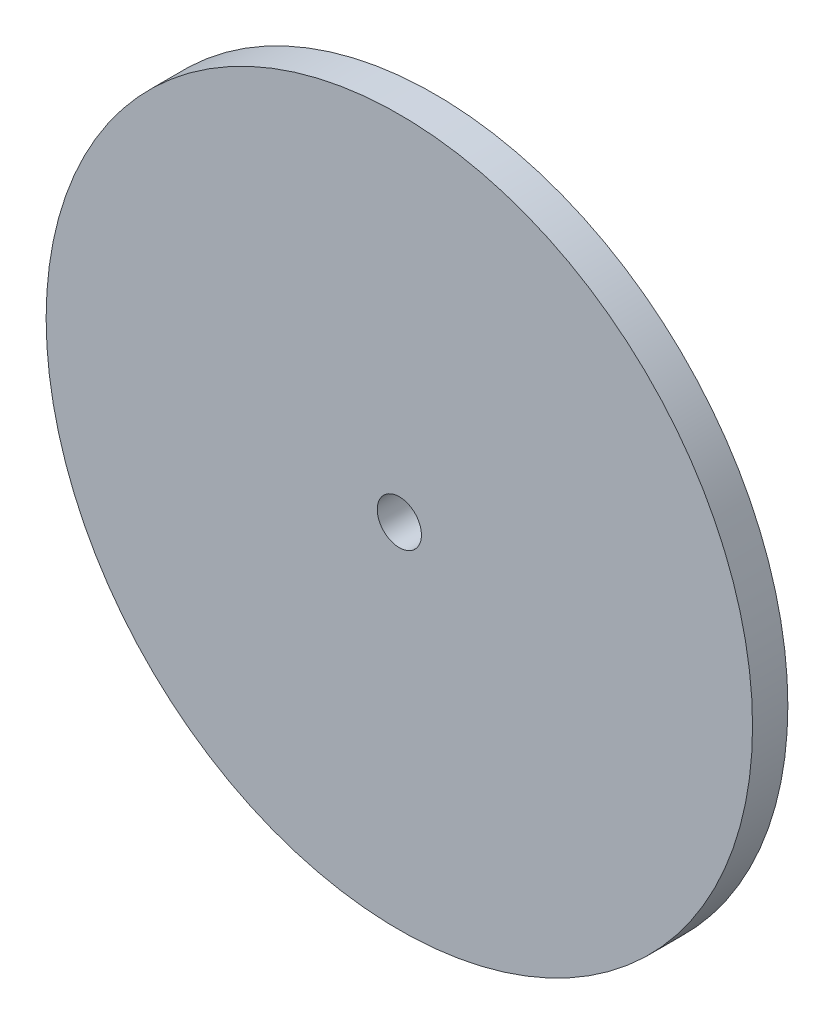
from build123d import *

# Parameters (mm, degrees)
ESQUISSE1_R             = 40
BOSS_EXTRU_1_DEPTH      = 4
ESQUISSE2_R             = 2.5
ENL_V_MAT_EXTRU_1_DEPTH = 57.709787515


with BuildPart() as part:
    # Esquisse1 → Boss.-Extru.1 (new body)
    with BuildSketch(Plane.XY):
        Circle(ESQUISSE1_R)
    extrude(amount=BOSS_EXTRU_1_DEPTH)

    # Esquisse2 → Enlèv. mat.-Extru.1 (cut, through all)
    with BuildSketch(Plane.XY.offset(4)):
        Circle(ESQUISSE2_R)
    extrude(amount=-ENL_V_MAT_EXTRU_1_DEPTH, mode=Mode.SUBTRACT)


solid = part.part
